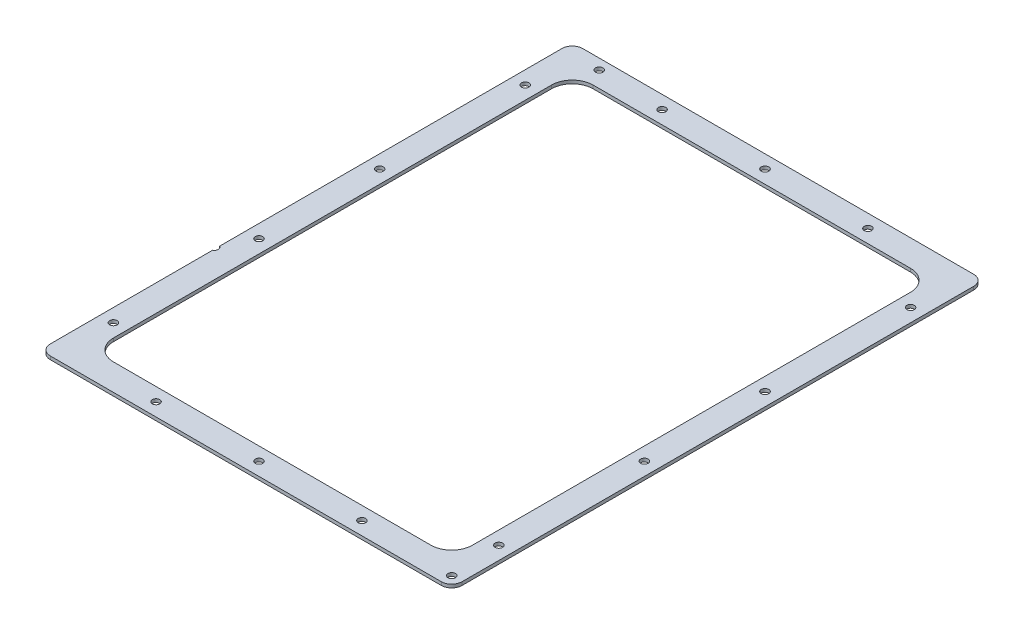
from build123d import *

# Parameters (mm, degrees)
SKETCH1_W            = 198
SKETCH1_H            = 256
SKETCH1_W_2          = 172.6
SKETCH1_H_2          = 230.6
MAINBODY_DEPTH       = 1.5875
M3_CLEARANCE_HOLE1_D = 3.6
INSIDEFILLET_R       = 10
FILLET2_R            = 5
M3_CLEARANCE_HOLE2_D = 3.6


with BuildPart() as part:
    # Sketch1 → MainBody (new body)
    with BuildSketch(Plane(origin=(0, 0, 0), x_dir=(1, 0, 0), z_dir=(0, 1, 0))):
        Rectangle(SKETCH1_W, SKETCH1_H)
        Rectangle(SKETCH1_W_2, SKETCH1_H_2, mode=Mode.SUBTRACT)
    extrude(amount=MAINBODY_DEPTH)

    # M3 Clearance Hole1 (through all)
    with Locations(Plane(origin=(0, 1.5875, 0), x_dir=(1, 0, 0), z_dir=(0, 1, 0))):
        with Locations((-92.65, 99), (-92.65, 29), (-92.65, -29), (-92.65, -99), (92.65, -99), (92.65, -29), (92.65, 29), (92.65, 99), (0, 121.65), (-49.5, 121.65), (49.5, -121.65), (0, -121.65), (-49.5, -121.65), (49.5, 121.65)):
            Hole(M3_CLEARANCE_HOLE1_D / 2)

    # InsideFillet
    insidefillet_edges = [part.edges().sort_by_distance(p)[0] for p in [
        (86.3, 0.79375, 115.3),
        (86.3, 0.79375, -115.3),
        (-86.3, 0.79375, -115.3),
        (-86.3, 0.79375, 115.3),
    ]]
    fillet(insidefillet_edges, radius=INSIDEFILLET_R)

    # Fillet2
    fillet2_edges = [part.edges().sort_by_distance(p)[0] for p in [
        (99, 0.79375, 128),
        (-99, 0.79375, 128),
        (-99, 0.79375, -128),
        (99, 0.79375, -128),
    ]]
    fillet(fillet2_edges, radius=FILLET2_R)

    # M3 Clearance Hole2 (through all)
    with Locations(Plane(origin=(0, 1.5875, 0), x_dir=(1, 0, 0), z_dir=(0, 1, 0))):
        with Locations((-81.072343025, 123), (106.927656975, 123), (94, -122.975), (-99.732934362, -43.278306391)):
            Hole(M3_CLEARANCE_HOLE2_D / 2)


solid = part.part
